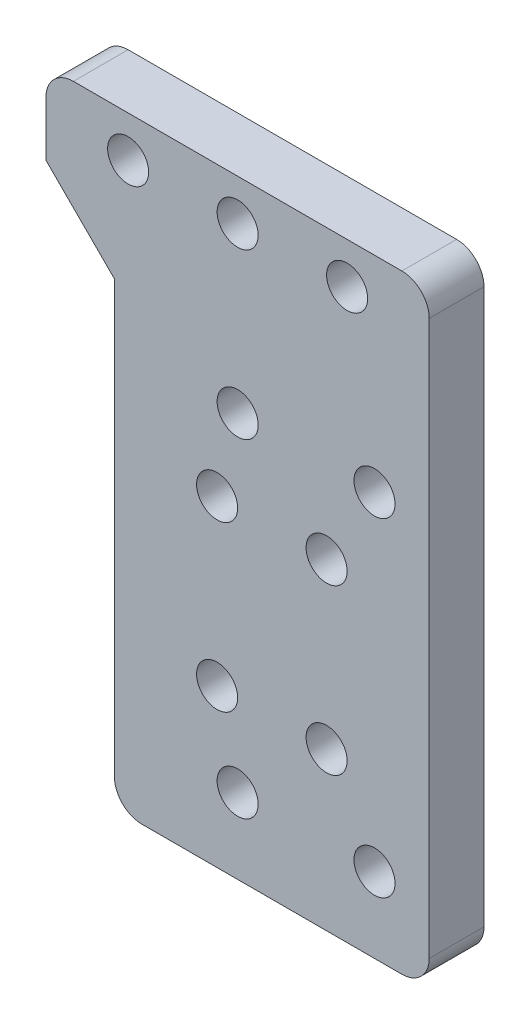
from build123d import *

# Parameters (mm, degrees)
SKETCH_2_R      = 1.5
EXTRUDE_1_DEPTH = 4
FILLET_1_R      = 2


with BuildPart() as part:
    # 草图2 → 凸台-拉伸1 (new body)
    with BuildSketch(Plane.XY):
        Polygon((-14, 22.25), (14, 22.25), (14, -22.25), (-9, -22.25), (-9, 11.25), (-14, 16.25), align=None)
        with Locations((0, 7.25)):
            Circle(SKETCH_2_R, mode=Mode.SUBTRACT)
        with Locations((-1.5, 1.25)):
            Circle(SKETCH_2_R, mode=Mode.SUBTRACT)
        with Locations((6.5, 1.25)):
            Circle(SKETCH_2_R, mode=Mode.SUBTRACT)
        with Locations((-1.5, -10.75)):
            Circle(SKETCH_2_R, mode=Mode.SUBTRACT)
        with Locations((6.5, -10.75)):
            Circle(SKETCH_2_R, mode=Mode.SUBTRACT)
        with Locations((10, 7.25)):
            Circle(SKETCH_2_R, mode=Mode.SUBTRACT)
        with Locations((0, -16.75)):
            Circle(SKETCH_2_R, mode=Mode.SUBTRACT)
        with Locations((10, -16.75)):
            Circle(SKETCH_2_R, mode=Mode.SUBTRACT)
        with Locations((8, 19.25)):
            Circle(SKETCH_2_R, mode=Mode.SUBTRACT)
        with Locations((0, 19.25)):
            Circle(SKETCH_2_R, mode=Mode.SUBTRACT)
        with Locations((-8, 19.25)):
            Circle(SKETCH_2_R, mode=Mode.SUBTRACT)
    extrude(amount=EXTRUDE_1_DEPTH)

    # 圆角1
    fillet_1_edges = [part.edges().sort_by_distance(p)[0] for p in [
        (14, -22.25, 2),
        (-9, -22.25, 2),
        (-14, 22.25, 2),
        (14, 22.25, 2),
    ]]
    fillet(fillet_1_edges, radius=FILLET_1_R)


solid = part.part
